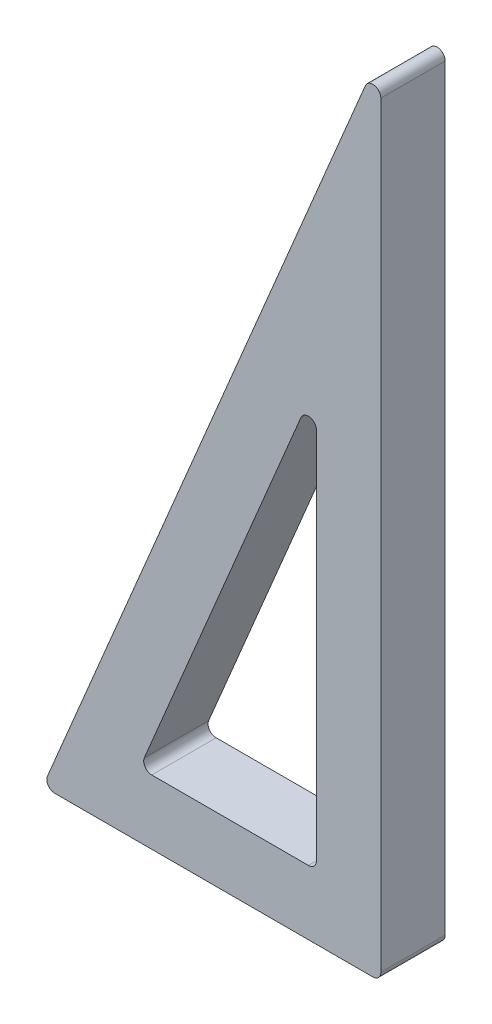
from build123d import *

# Parameters (mm, degrees)
EXTRUDE_1_DEPTH     = 8
FILLET_1_R          = 1
CUT_EXTRUDE_1_DEPTH = 36
FILLET_2_R          = 1


with BuildPart() as part:
    # 스케치1 → 보스-돌출1 (new body)
    with BuildSketch(Plane.XY):
        Polygon((21, 50), (21, -50), (-21, -50), align=None)
    extrude(amount=EXTRUDE_1_DEPTH)

    # 필렛1
    fillet_1_edges = [part.edges().sort_by_distance(p)[0] for p in [
        (21, -50, 4),
        (-21, -50, 4),
        (21, 50, 4),
    ]]
    fillet(fillet_1_edges, radius=FILLET_1_R)

    # 스케치2 → 컷-돌출1 (cut)
    with BuildSketch(Plane.XY.offset(8)):
        Polygon((13, -42), (13, 10.292957161), (-8.963042008, -42), align=None)
    extrude(amount=-CUT_EXTRUDE_1_DEPTH, mode=Mode.SUBTRACT)

    # 필렛2
    fillet_2_edges = [part.edges().sort_by_distance(p)[0] for p in [
        (13, 10.292957161, 4),
        (13, -42, 4),
        (-8.963042008, -42, 4),
    ]]
    fillet(fillet_2_edges, radius=FILLET_2_R)


solid = part.part
